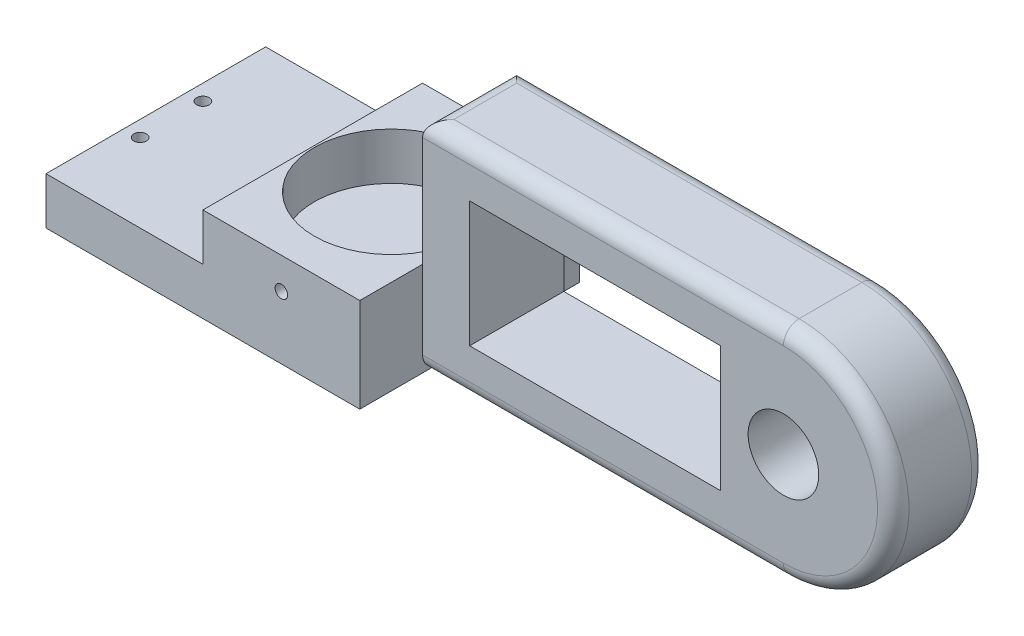
from build123d import *

# Parameters (mm, degrees)
SKETCH_1_W               = 300
SKETCH_1_H               = 140
EXTRUDE_1_DEPTH          = 60
CUT_EXTRUDE_1_DEPTH      = 60
SKETCH_4_W               = 160
SKETCH_4_H               = 80
CUT_EXTRUDE_2_DEPTH      = 177.068168617
SKETCH_5_W               = 20
SKETCH_5_H               = 20
CUT_EXTRUDE_3_DEPTH      = 177.068168617
SKETCH_12_W              = 140
SKETCH_12_H              = 30
EXTRUDE_2_DEPTH          = 200
SKETCH_13_W              = 100
SKETCH_13_H              = 140
EXTRUDE_3_DEPTH          = 30
SKETCH_14_R              = 49
CUT_EXTRUDE_4_DEPTH      = 30
CUT_EXTRUDE_5_DEPTH      = 30
FILLET_3_R               = 10
SKETCH_17_R              = 22.5
CUT_EXTRUDE_6_DEPTH      = 49.178012217
CUT_EXTRUDE_7_DEPTH      = 368.903136522
CUT_EXTRUDE_7_DEPTH_BACK = 50
SKETCH_18_R              = 1.5
CUT_EXTRUDE_8_DEPTH      = 384.405790254


with BuildPart() as part:
    # 草图1 → 凸台-拉伸1 (new body)
    with BuildSketch(Plane.XY):
        Rectangle(SKETCH_1_W, SKETCH_1_H)
    extrude(amount=EXTRUDE_1_DEPTH)

    # 草图2 → 切除-拉伸1 (cut)
    with BuildSketch(Plane.XY.offset(60)):
        with BuildLine():
            Line((150, 0), (150, 70))
            Line((150, 70), (80, 70))
            ThreePointArc((80, 70), (129.497474683, 49.497474683), (150, 0))
        make_face()
        with BuildLine():
            Line((80, -70), (150, -70))
            Line((150, -70), (129.497474683, -49.497474683))
            ThreePointArc((129.497474683, -49.497474683), (106.787840266, -64.671567276), (80, -70))
        make_face()
        with BuildLine():
            Line((150, -70), (150, 0))
            ThreePointArc((150, 0), (144.671567276, -26.787840266), (129.497474683, -49.497474683))
            Line((129.497474683, -49.497474683), (150, -70))
        make_face()
    extrude(amount=-CUT_EXTRUDE_1_DEPTH, mode=Mode.SUBTRACT)

    # 草图4 → 切除-拉伸2 (cut, through all)
    with BuildSketch(Plane.XY.offset(60)):
        with Locations((-40, 0)):
            Rectangle(SKETCH_4_W, SKETCH_4_H)
    extrude(amount=-CUT_EXTRUDE_2_DEPTH, mode=Mode.SUBTRACT)

    # 草图5 → 切除-拉伸3 (cut, through all)
    with BuildSketch(Plane(origin=(0, 0, 0), x_dir=(-1, 0, 0), z_dir=(0, 0, -1))):
        with Locations((-80, 0)):
            Rectangle(SKETCH_5_W, SKETCH_5_H)
    extrude(amount=-CUT_EXTRUDE_3_DEPTH, mode=Mode.SUBTRACT)

    # 草图12 → 凸台-拉伸2 (add)
    with BuildSketch(Plane.ZY.offset(150)):
        with Locations((30, -55)):
            Rectangle(SKETCH_12_W, SKETCH_12_H)
    extrude(amount=EXTRUDE_2_DEPTH)

    # 草图13 → 凸台-拉伸3 (add)
    with BuildSketch(Plane(origin=(0, -40, 0), x_dir=(1, 0, 0), z_dir=(0, 1, 0))):
        with Locations((-200, -30)):
            Rectangle(SKETCH_13_W, SKETCH_13_H)
    extrude(amount=EXTRUDE_3_DEPTH)

    # 草图14 → 切除-拉伸4 (cut)
    with BuildSketch(Plane(origin=(0, -10, 0), x_dir=(1, 0, 0), z_dir=(0, 1, 0))):
        with Locations(Location((-200, -30, 0), (0, 0, 270))):
            Circle(SKETCH_14_R)
    extrude(amount=-CUT_EXTRUDE_4_DEPTH, mode=Mode.SUBTRACT)

    # 草图15 → 切除-拉伸5 (cut)
    with BuildSketch(Plane(origin=(0, -40, 0), x_dir=(1, 0, 0), z_dir=(0, 1, 0))):
        with BuildLine():
            ThreePointArc((-336, -50), (-337.171572875, -47.171572875), (-340, -46))
            Line((-340, -46), (-340, -54))
            ThreePointArc((-340, -54), (-337.171572875, -52.828427125), (-336, -50))
        make_face()
        with BuildLine():
            Line((-340, -54), (-340, -46))
            ThreePointArc((-340, -46), (-344, -50), (-340, -54))
        make_face()
        with BuildLine():
            ThreePointArc((-336, -10), (-337.171572875, -7.171572875), (-340, -6))
            Line((-340, -6), (-340, -14))
            ThreePointArc((-340, -14), (-337.171572875, -12.828427125), (-336, -10))
        make_face()
        with BuildLine():
            Line((-340, -14), (-340, -6))
            ThreePointArc((-340, -6), (-344, -10), (-340, -14))
        make_face()
    extrude(amount=-CUT_EXTRUDE_5_DEPTH, mode=Mode.SUBTRACT)

    # 圆角3
    fillet_3_edges = [part.edges().sort_by_distance(p)[0] for p in [
        (-35, 70, 0),
        (-35, 70, 60),
        (-35, -70, 60),
        (150, 0, 60),
        (150, 0, 0),
        (-35, -70, 0),
        (-150, 70, 30),
    ]]
    fillet(fillet_3_edges, radius=FILLET_3_R)

    # 草图17 → 切除-拉伸6 (cut)
    with BuildSketch(Plane.XY.offset(60)):
        with Locations((80, 0)):
            Circle(SKETCH_17_R)
    extrude(amount=-CUT_EXTRUDE_6_DEPTH, mode=Mode.SUBTRACT)

    # 草图18 → 切除-拉伸7 (cut, two sides: drawn at the far end of the back side and taken through both)
    with BuildSketch(Plane.XY.offset(10.821987783).offset(-CUT_EXTRUDE_7_DEPTH_BACK)):
        with Locations(Location((80, 17.5, 0), (0, 0, 180))):
            Circle(SKETCH_18_R)
        with Locations(Location((95.155444566, 8.75, 0), (0, 0, 180))):
            Circle(SKETCH_18_R)
        with Locations(Location((95.155444566, -8.75, 0), (0, 0, 180))):
            Circle(SKETCH_18_R)
        with Locations(Location((80, -17.5, 0), (0, 0, 180))):
            Circle(SKETCH_18_R)
        with Locations(Location((64.844555434, -8.75, 0), (0, 0, 180))):
            Circle(SKETCH_18_R)
        with Locations(Location((64.844555434, 8.75, 0), (0, 0, 180))):
            Circle(SKETCH_18_R)
    extrude(amount=CUT_EXTRUDE_7_DEPTH + CUT_EXTRUDE_7_DEPTH_BACK, mode=Mode.SUBTRACT)

    # 草图19 → 切除-拉伸8 (cut, through all)
    with BuildSketch(Plane.XY.offset(100)):
        with BuildLine():
            ThreePointArc((-196, -30), (-200, -26), (-204, -30))
            Line((-204, -30), (-196, -30))
        make_face()
        with BuildLine():
            Line((-196, -30), (-204, -30))
            ThreePointArc((-204, -30), (-200, -34), (-196, -30))
        make_face()
    extrude(amount=-CUT_EXTRUDE_8_DEPTH, mode=Mode.SUBTRACT)


solid = part.part
